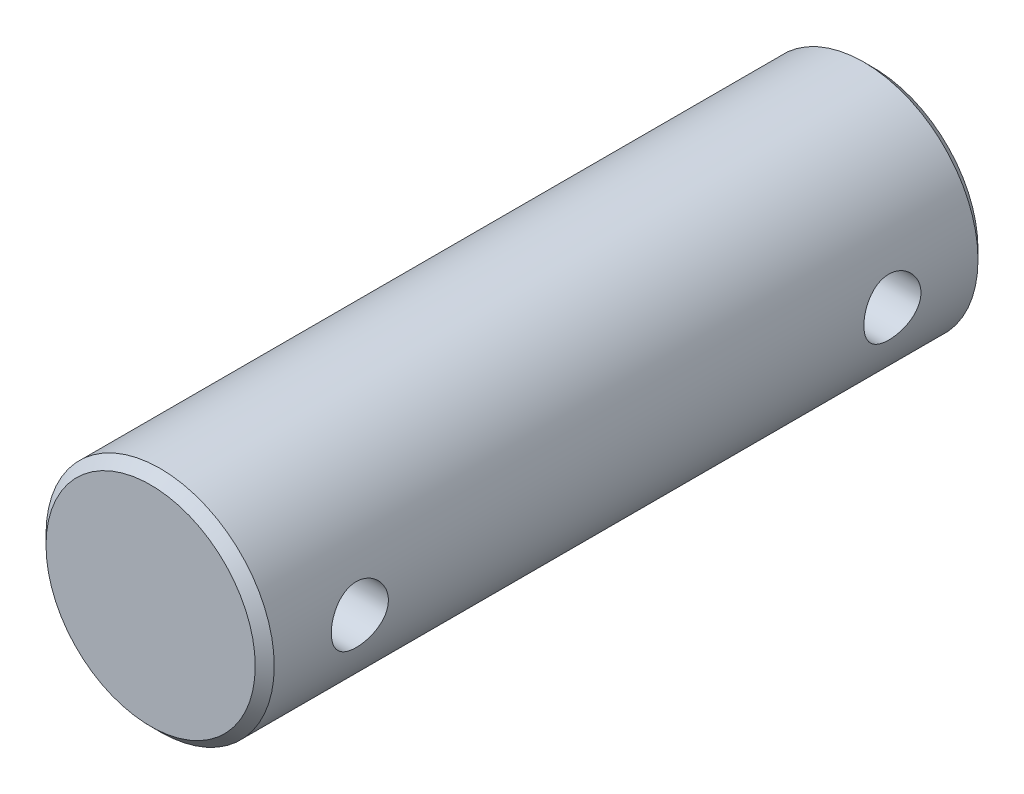
from build123d import *

# Parameters (mm, degrees)
SKETCH1_R           = 6
BOSS_EXTRUDE1_DEPTH = 19
CHAMFER1_SIZE       = 0.5
SKETCH2_R           = 1.5
CUT_EXTRUDE1_DEPTH  = 19


with BuildPart() as part:
    # Sketch1 → Boss-Extrude1 (new, symmetric)
    with BuildSketch(Plane.XY):
        Circle(SKETCH1_R)
    extrude(amount=BOSS_EXTRUDE1_DEPTH, both=True)

    # Chamfer1
    chamfer1_edges = [part.edges().sort_by_distance(p)[0] for p in [
        (-6, 0, -19),
        (-6, 0, 19),
    ]]
    chamfer(chamfer1_edges, length=CHAMFER1_SIZE)

    # Sketch2 → Cut-Extrude1 (cut, symmetric)
    with BuildSketch(Plane(origin=(0, 0, 0), x_dir=(0, 0, -1), z_dir=(1, 0, 0))):
        with Locations(Location((-14, 0, 0), (0, 0, 180))):
            Circle(SKETCH2_R)
        with Locations(Location((14, 0, 0), (0, 0, 180))):
            Circle(SKETCH2_R)
    extrude(amount=CUT_EXTRUDE1_DEPTH, both=True, mode=Mode.SUBTRACT)


solid = part.part
